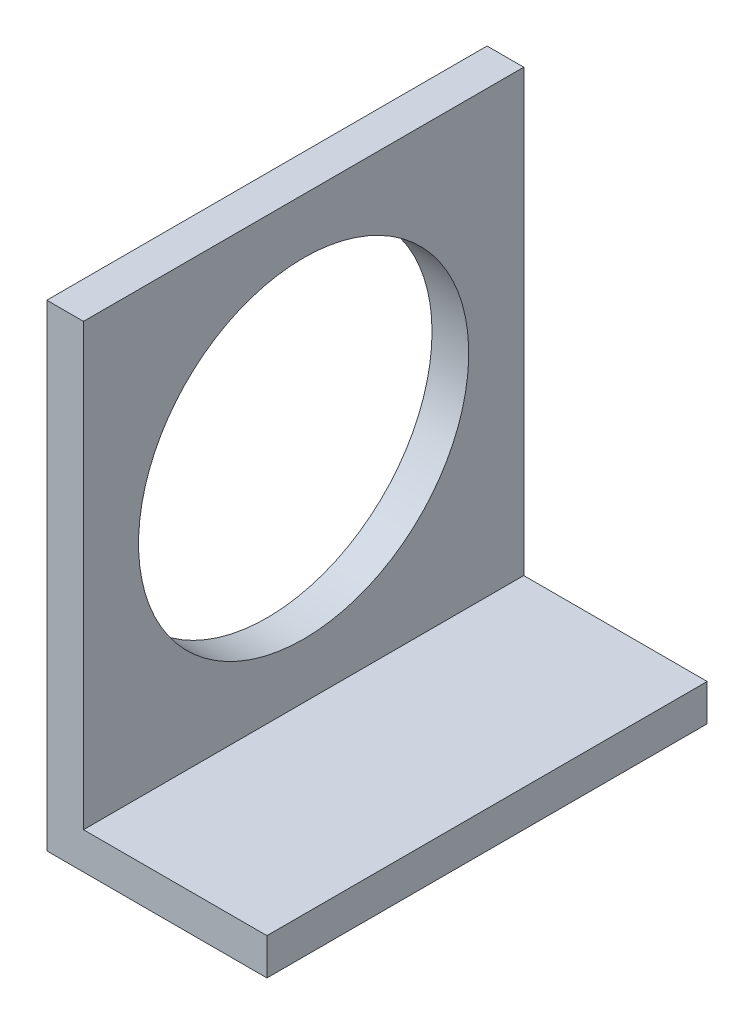
from build123d import *

# Parameters (mm, degrees)
BOSS_EXTRUDE1_DEPTH = 60
SKETCH8_R           = 22.5
CUT_EXTRUDE1_DEPTH  = 60


with BuildPart() as part:
    # Sketch7 → Boss-Extrude1 (new body)
    with BuildSketch(Plane.XY):
        Polygon((0, 0), (0, 65), (5, 65), (5, 5), (30, 5), (30, 0), align=None)
    extrude(amount=BOSS_EXTRUDE1_DEPTH)

    # Sketch8 → Cut-Extrude1 (cut)
    with BuildSketch(Plane(origin=(5, 0, 0), x_dir=(0, 0, -1), z_dir=(1, 0, 0))):
        with Locations(Location((-30, 35, 0), (0, 0, 90))):
            Circle(SKETCH8_R)
    extrude(amount=-CUT_EXTRUDE1_DEPTH, mode=Mode.SUBTRACT)


solid = part.part
